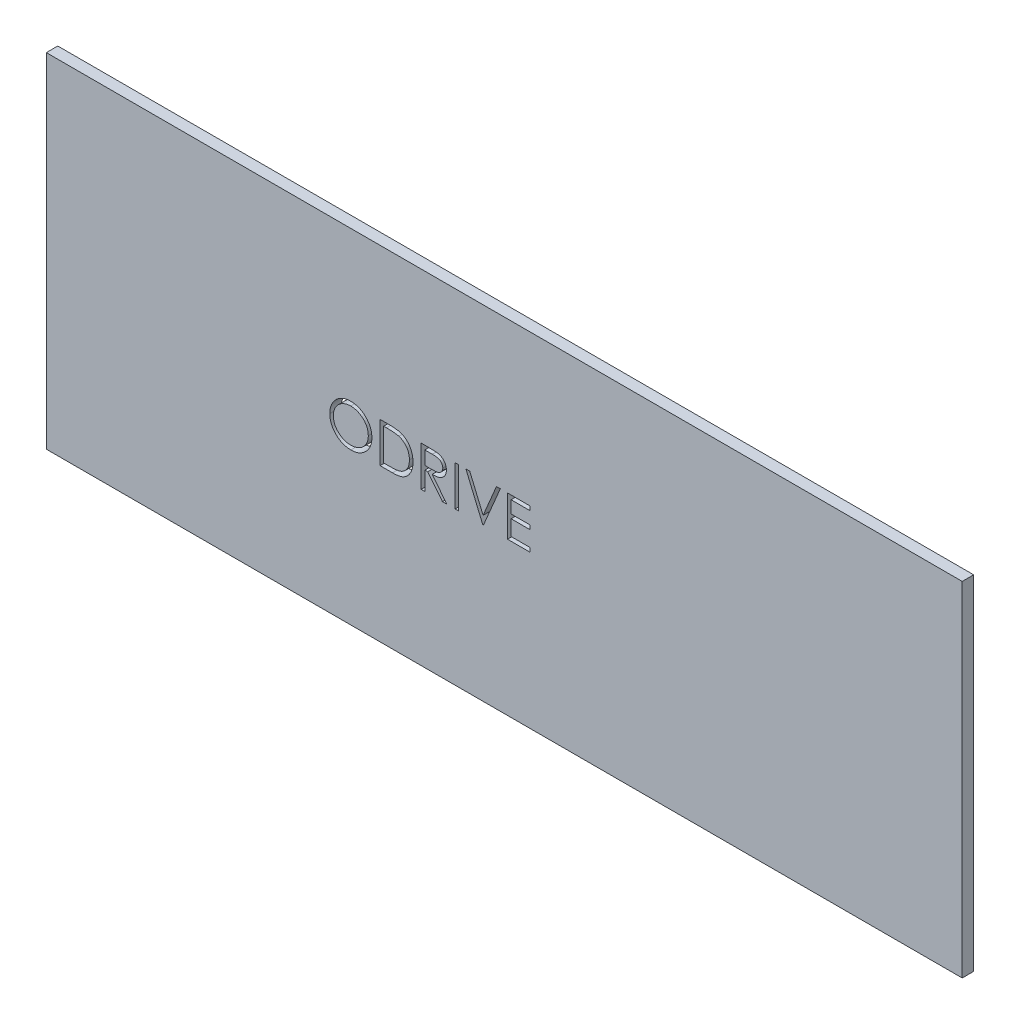
from build123d import *

# Parameters (mm, degrees)
SKETCH1_W           = 80
SKETCH1_H           = 30
BOSS_EXTRUDE1_DEPTH = 1
SKETCH2_W           = 0.314102564
SKETCH2_H           = 3.5
CUT_EXTRUDE2_DEPTH  = 68.789385784


with BuildPart() as part:
    # Sketch1 → Boss-Extrude1 (new body)
    with BuildSketch(Plane.XY):
        with Locations((-14.402403846, -25.432403846)):
            Rectangle(SKETCH1_W, SKETCH1_H)
    extrude(amount=BOSS_EXTRUDE1_DEPTH)

    # Sketch2 → Cut-Extrude2 (cut, through all)
    # profile 1 of 6: a face of its own
    with BuildSketch(Plane.XY.offset(1)):
        with BuildLine():
            add(Edge.make_bspline(
                [(-27.828685897, -23.509326923), (-27.763877792, -23.510968402), (-27.636589325, -23.514192403), (-27.449514427, -23.538871507), (-27.270919332, -23.581566897), (-27.099349193, -23.638429879), (-26.936856216, -23.714284265), (-26.782217324, -23.805969413), (-26.63580045, -23.914445872), (-26.499579068, -24.038875099), (-26.374922118, -24.174258553), (-26.265096232, -24.318736463), (-26.173053938, -24.471435265), (-26.097468151, -24.631896096), (-26.038169541, -24.799756064), (-25.997250498, -24.975910066), (-25.971112347, -25.159216756), (-25.96805657, -25.284243621), (-25.96650641, -25.347668269)],
                knots=[0, 0, 0, 0, 1.065120563, 2.091984664, 3.0946048, 4.079830382, 5.057816894, 6.036188127, 7.030412546, 8.04752943, 9.064399622, 10.05169764, 11.02544977, 11.989514704, 12.962713494, 13.945757189, 14.957906945, 16, 16, 16, 16], degree=3))
            add(Edge.make_bspline(
                [(-25.96650641, -25.347668269), (-25.968056343, -25.410625716), (-25.971111439, -25.534722136), (-25.997280217, -25.71686558), (-26.038321217, -25.891956277), (-26.096917483, -26.059701929), (-26.172142962, -26.220279493), (-26.264798133, -26.373266447), (-26.373939343, -26.518712945), (-26.498146194, -26.655025611), (-26.633547236, -26.780023081), (-26.778777503, -26.888941957), (-26.930570823, -26.982666082), (-27.090880531, -27.057449756), (-27.257580568, -27.117221676), (-27.432162891, -27.157974306), (-27.613809445, -27.184261349), (-27.737680449, -27.187279865), (-27.800641026, -27.188814103)],
                knots=[0, 0, 0, 0, 1.043624062, 2.057103931, 3.04512605, 4.022047818, 4.998200453, 5.980619268, 6.982898556, 8.009068085, 9.034988726, 10.034168286, 11.015286542, 11.987931943, 12.962482838, 13.94673481, 14.956375938, 16, 16, 16, 16], degree=3))
            add(Edge.make_bspline(
                [(-27.800641026, -27.188814103), (-27.864065345, -27.187264716), (-27.989091561, -27.184210462), (-28.172628596, -27.158029057), (-28.34890634, -27.117087753), (-28.517420691, -27.058578317), (-28.678265621, -26.982961086), (-28.831755703, -26.890756707), (-28.977274851, -26.781349566), (-29.113616597, -26.657182991), (-29.238365795, -26.522011439), (-29.347125171, -26.377177184), (-29.439350284, -26.225521728), (-29.514713617, -26.066624204), (-29.574378076, -25.901252761), (-29.615082894, -25.728304283), (-29.641418846, -25.548764778), (-29.644453693, -25.426521879), (-29.64599359, -25.364495192)],
                knots=[0, 0, 0, 0, 1.053102029, 2.075944431, 3.073151272, 4.055350789, 5.033113405, 6.020478099, 7.024410459, 8.052272461, 9.079885166, 10.07527673, 11.055994387, 12.023226415, 12.992069828, 13.970394897, 14.97016774, 16, 16, 16, 16], degree=3))
            add(Edge.make_bspline(
                [(-29.64599359, -25.364495192), (-29.645458954, -25.322862523), (-29.644396428, -25.2401224), (-29.631604735, -25.1172558), (-29.613043034, -24.996365142), (-29.586441122, -24.877794194), (-29.551649455, -24.761833209), (-29.510597427, -24.647682446), (-29.460457582, -24.536498722), (-29.403776934, -24.427755331), (-29.340515126, -24.323147425), (-29.270639376, -24.224267842), (-29.196604008, -24.130286845), (-29.115440614, -24.043639841), (-29.029824169, -23.961806185), (-28.938365791, -23.886043468), (-28.841623547, -23.815668517), (-28.739181167, -23.752248176), (-28.633562892, -23.694889041), (-28.524686114, -23.64566719), (-28.414029543, -23.603421129), (-28.301074895, -23.569180303), (-28.186122123, -23.542148267), (-28.068920338, -23.523740914), (-27.949562912, -23.510916596), (-27.869151593, -23.509859094), (-27.828685897, -23.509326923)],
                knots=[0, 0, 0, 0, 1.037015668, 2.060948919, 3.074880161, 4.083647147, 5.086022904, 6.090072063, 7.104153813, 8.122640571, 9.144368836, 10.147691507, 11.138137339, 12.123020368, 13.103399296, 14.087645067, 15.080126199, 16.082011238, 17.087798457, 18.072939717, 19.057185487, 20.037253025, 21.01195951, 21.997135196, 22.992090687, 24, 24, 24, 24], degree=3))
        make_face()
        with BuildLine():
            add(Edge.make_bspline(
                [(-27.813261218, -23.868301282), (-27.846475851, -23.868706172), (-27.912587584, -23.869512082), (-28.010872121, -23.880127798), (-28.107864055, -23.895257687), (-28.203583417, -23.916839207), (-28.297629706, -23.94624326), (-28.390879547, -23.980084168), (-28.482482601, -24.021305259), (-28.572136459, -24.067877963), (-28.659051534, -24.119426884), (-28.741064236, -24.176398651), (-28.81838688, -24.237457205), (-28.890830146, -24.302745043), (-28.958181318, -24.372594645), (-29.02176602, -24.445947081), (-29.079035601, -24.524898972), (-29.131521178, -24.607309379), (-29.178489019, -24.69307096), (-29.220254373, -24.781280822), (-29.254418382, -24.872658509), (-29.282280758, -24.966212666), (-29.305380569, -25.061795126), (-29.320014493, -25.160130975), (-29.330746853, -25.260726087), (-29.331506698, -25.328707941), (-29.331891026, -25.363092949)],
                knots=[0, 0, 0, 0, 1.008559885, 2.007477868, 2.99961109, 3.989939068, 4.984837346, 5.991145699, 7.001802488, 8.033829008, 9.059044045, 10.069351652, 11.065060232, 12.050310815, 13.029377138, 14.011219647, 14.996725999, 15.989392538, 16.977580475, 17.965360261, 18.951710183, 19.937753436, 20.929683414, 21.935841486, 22.955955122, 24, 24, 24, 24], degree=3))
            add(Edge.make_bspline(
                [(-29.331891026, -25.363092949), (-29.330616164, -25.41365517), (-29.328108116, -25.5131267), (-29.306150546, -25.658894844), (-29.272328571, -25.79898313), (-29.222471205, -25.932625039), (-29.16012059, -26.060969322), (-29.0830937, -26.182877427), (-28.991834614, -26.298382301), (-28.888171088, -26.40667757), (-28.774848381, -26.505523374), (-28.654515651, -26.592286783), (-28.528462044, -26.665697033), (-28.396358841, -26.725502105), (-28.258911302, -26.772891843), (-28.115233751, -26.805370474), (-27.966283291, -26.82674593), (-27.864752636, -26.828798685), (-27.813261218, -26.829839744)],
                knots=[0, 0, 0, 0, 1.032063989, 2.030389145, 3.003944642, 3.970395727, 4.937377036, 5.913328081, 6.909231446, 7.93887556, 8.970685674, 9.976071282, 10.964166581, 11.944589148, 12.933237628, 13.927779006, 14.949070134, 16, 16, 16, 16], degree=3))
            add(Edge.make_bspline(
                [(-27.813261218, -26.829839744), (-27.778651716, -26.829364239), (-27.71001068, -26.828421171), (-27.607915158, -26.818922494), (-27.507658946, -26.803690625), (-27.409382666, -26.781759969), (-27.313197855, -26.754312763), (-27.218703051, -26.721705035), (-27.126904761, -26.681023831), (-27.036644923, -26.63607588), (-26.950248682, -26.584835722), (-26.867773149, -26.529797573), (-26.79129717, -26.468828952), (-26.718908098, -26.404511139), (-26.651280409, -26.335547291), (-26.588871425, -26.26202707), (-26.531891293, -26.183486412), (-26.479425646, -26.101201007), (-26.432622383, -26.015204754), (-26.391843284, -25.926675076), (-26.357247169, -25.835829967), (-26.329318664, -25.742538395), (-26.307433202, -25.646977546), (-26.292353282, -25.549019468), (-26.281804843, -25.448860126), (-26.281009766, -25.38111627), (-26.280608974, -25.346967147)],
                knots=[0, 0, 0, 0, 1.047197238, 2.076906641, 3.100256066, 4.114471768, 5.12198147, 6.126382909, 7.136867548, 8.15857795, 9.17633901, 10.174870724, 11.156907918, 12.133735059, 13.104061851, 14.077631395, 15.04955518, 16.038496417, 17.029181396, 18.010275684, 18.986308667, 19.968651475, 20.955262928, 21.950658345, 22.966943676, 24, 24, 24, 24], degree=3))
            add(Edge.make_bspline(
                [(-26.280608974, -25.346967147), (-26.281010087, -25.313051643), (-26.281805769, -25.245773993), (-26.292348243, -25.146313175), (-26.307449134, -25.049059963), (-26.329211842, -24.95439616), (-26.357261996, -24.862297635), (-26.391849326, -24.772850887), (-26.432634625, -24.685722692), (-26.47944285, -24.601128395), (-26.532058673, -24.519953657), (-26.589552917, -24.442351245), (-26.652918265, -24.369778503), (-26.72034429, -24.300443809), (-26.793515175, -24.23582592), (-26.872099469, -24.175903399), (-26.955143147, -24.119230125), (-27.043070382, -24.068104563), (-27.133814336, -24.02089033), (-27.226928294, -23.980439327), (-27.321357394, -23.946067208), (-27.416861506, -23.916750243), (-27.514244484, -23.895342213), (-27.612848313, -23.880114163), (-27.712536572, -23.869515777), (-27.779579791, -23.868707398), (-27.813261218, -23.868301282)],
                knots=[0, 0, 0, 0, 1.02996197, 2.043119294, 3.035359645, 4.018872909, 4.991431989, 5.957985074, 6.929999688, 7.912076566, 8.892894881, 9.867085534, 10.843653904, 11.817741046, 12.803660682, 13.806313499, 14.818574707, 15.856120519, 16.894564902, 17.924820532, 18.937903209, 19.946497019, 20.957711757, 21.963978472, 22.977135795, 24, 24, 24, 24], degree=3))
        make_face(mode=Mode.SUBTRACT)
    # profile 2 of 6: a face of its own
    with BuildSketch(Plane.XY.offset(1)):
        with BuildLine():
            Line((-25.248557692, -27.099070513), (-25.248557692, -23.599070513))
            Line((-25.248557692, -23.599070513), (-24.541826923, -23.599070513))
            add(Edge.make_bspline(
                [(-24.541826923, -23.599070513), (-24.480357935, -23.599513083), (-24.36160017, -23.600368126), (-24.189987722, -23.605789517), (-24.03120396, -23.615379983), (-23.885771101, -23.629349509), (-23.753289889, -23.646502542), (-23.63413128, -23.668002947), (-23.527679138, -23.693391117), (-23.462209697, -23.715036567), (-23.43125, -23.725272436)],
                knots=[0, 0, 0, 0, 1.314313732, 2.53924729, 3.670748893, 4.714932338, 5.66265055, 6.526160246, 7.303039223, 8, 8, 8, 8], degree=3))
            add(Edge.make_bspline(
                [(-23.43125, -23.725272436), (-23.390755261, -23.740703142), (-23.310684068, -23.771214636), (-23.196676946, -23.828770937), (-23.089351583, -23.893984039), (-22.988132438, -23.966939901), (-22.895331612, -24.04970425), (-22.807323715, -24.138761336), (-22.727708991, -24.237349676), (-22.654800695, -24.343424664), (-22.589065036, -24.455736716), (-22.531925878, -24.574071825), (-22.484471884, -24.697829033), (-22.445078658, -24.826664181), (-22.4140322, -24.960860558), (-22.392850269, -25.100574425), (-22.378879279, -25.245253614), (-22.377475227, -25.343428078), (-22.376762821, -25.393241186)],
                knots=[0, 0, 0, 0, 0.984719456, 1.947108742, 2.898477687, 3.838006223, 4.779231079, 5.722358779, 6.681677486, 7.655904652, 8.64651281, 9.637519902, 10.640069247, 11.656948941, 12.698408672, 13.768548281, 14.867775369, 16, 16, 16, 16], degree=3))
            add(Edge.make_bspline(
                [(-22.376762821, -25.393241186), (-22.377391788, -25.436502424), (-22.378631234, -25.521753213), (-22.38976055, -25.647394109), (-22.40593687, -25.76930768), (-22.430981068, -25.88691338), (-22.461383581, -26.001241598), (-22.500347733, -26.111073843), (-22.544983229, -26.217417652), (-22.597033107, -26.318835128), (-22.654174492, -26.4149185), (-22.715496236, -26.505494028), (-22.780932931, -26.58926925), (-22.851108564, -26.666497862), (-22.92511628, -26.73706344), (-23.003440611, -26.801555456), (-23.086283662, -26.858712011), (-23.173274384, -26.910779119), (-23.266950514, -26.956199474), (-23.36908638, -26.994629484), (-23.480117558, -27.0264761), (-23.599771515, -27.053046995), (-23.728254992, -27.074124298), (-23.865693958, -27.08825069), (-24.011877248, -27.097803623), (-24.112256513, -27.098640017), (-24.163922276, -27.099070513)],
                knots=[0, 0, 0, 0, 1.105936401, 2.179363191, 3.223086493, 4.248585256, 5.251745608, 6.245858792, 7.225916811, 8.198733463, 9.158002045, 10.082870192, 10.993790845, 11.873723703, 12.748670949, 13.606408763, 14.465103618, 15.319838547, 16.196477973, 17.123216899, 18.106603292, 19.147568657, 20.255746949, 21.433717677, 22.679120308, 24, 24, 24, 24], degree=3))
            Line((-24.163922276, -27.099070513), (-25.248557692, -27.099070513))
        make_face()
        with BuildLine():
            Line((-24.934455128, -26.740096154), (-24.53271234, -26.740096154))
            add(Edge.make_bspline(
                [(-24.53271234, -26.740096154), (-24.474983969, -26.739848057), (-24.363951171, -26.739370877), (-24.204293173, -26.735183674), (-24.058413777, -26.728341737), (-23.926292267, -26.718766659), (-23.808003243, -26.706098044), (-23.703299493, -26.691973141), (-23.612524235, -26.67437569), (-23.557594798, -26.658424731), (-23.532211538, -26.651053686)],
                knots=[0, 0, 0, 0, 1.375205317, 2.645023457, 3.804390687, 4.853969522, 5.800190428, 6.637939096, 7.370582563, 8, 8, 8, 8], degree=3))
            add(Edge.make_bspline(
                [(-23.532211538, -26.651053686), (-23.500263176, -26.639802128), (-23.437129538, -26.617567754), (-23.346248453, -26.577010093), (-23.261491448, -26.528968023), (-23.181381423, -26.475565749), (-23.107054768, -26.414919747), (-23.037630651, -26.348348759), (-22.97324885, -26.275513984), (-22.914574542, -26.196505822), (-22.862066238, -26.111816026), (-22.816595009, -26.022277193), (-22.776743477, -25.928870382), (-22.745464884, -25.830161224), (-22.7209493, -25.727032165), (-22.703584612, -25.619475952), (-22.692769888, -25.50751267), (-22.69150844, -25.431360546), (-22.690865385, -25.392540064)],
                knots=[0, 0, 0, 0, 0.998632004, 1.973411704, 2.929992603, 3.868527914, 4.809262121, 5.754881198, 6.702106254, 7.672490631, 8.653608572, 9.636854334, 10.631411391, 11.644891563, 12.686317036, 13.754757253, 14.855430412, 16, 16, 16, 16], degree=3))
            add(Edge.make_bspline(
                [(-22.690865385, -25.392540064), (-22.691378672, -25.351606584), (-22.69238703, -25.271192399), (-22.70506134, -25.153201704), (-22.723582895, -25.039721054), (-22.750366582, -24.930742858), (-22.78449746, -24.826054506), (-22.827092102, -24.726234996), (-22.875758721, -24.630230127), (-22.933662058, -24.540255761), (-22.997077652, -24.455162652), (-23.067455531, -24.377207737), (-23.143677569, -24.306213436), (-23.224912419, -24.241074124), (-23.313449518, -24.184410448), (-23.407203209, -24.133723767), (-23.50754888, -24.090707875), (-23.577361576, -24.067829013), (-23.612840545, -24.056201923)],
                knots=[0, 0, 0, 0, 1.122418816, 2.205001699, 3.251619955, 4.274784885, 5.280384055, 6.268708349, 7.249350384, 8.229342522, 9.199999885, 10.157847722, 11.105861043, 12.055065948, 13.010012805, 13.98527497, 14.976112212, 16, 16, 16, 16], degree=3))
            add(Edge.make_bspline(
                [(-23.612840545, -24.056201923), (-23.642191691, -24.048085495), (-23.704600282, -24.030827743), (-23.806439746, -24.01200237), (-23.921054895, -23.995397871), (-24.048954596, -23.981339832), (-24.189993055, -23.97125251), (-24.344278743, -23.963681196), (-24.511878348, -23.958574563), (-24.628060882, -23.958225856), (-24.688361378, -23.958044872)],
                knots=[0, 0, 0, 0, 0.674548936, 1.434276114, 2.292660221, 3.240891867, 4.284742987, 5.42552168, 6.663806718, 8, 8, 8, 8], degree=3))
            Line((-24.688361378, -23.958044872), (-24.934455128, -23.958044872))
            Line((-24.934455128, -23.958044872), (-24.934455128, -26.740096154))
        make_face(mode=Mode.SUBTRACT)
    # profile 3 of 6: a face of its own
    with BuildSketch(Plane.XY.offset(1)):
        with BuildLine():
            Line((-21.658814103, -23.599070513), (-20.958393429, -23.599070513))
            add(Edge.make_bspline(
                [(-20.958393429, -23.599070513), (-20.911652301, -23.599226099), (-20.821904157, -23.599524841), (-20.693330886, -23.601190604), (-20.576503789, -23.60596496), (-20.47148395, -23.610073543), (-20.378273295, -23.617565485), (-20.296586004, -23.624726132), (-20.226798307, -23.634099792), (-20.184552455, -23.642805215), (-20.165424679, -23.646746795)],
                knots=[0, 0, 0, 0, 1.410062039, 2.707475311, 3.878576406, 4.937260626, 5.877586885, 6.699081471, 7.410979367, 8, 8, 8, 8], degree=3))
            add(Edge.make_bspline(
                [(-20.165424679, -23.646746795), (-20.139818055, -23.65307356), (-20.089151066, -23.665592124), (-20.016201, -23.692051725), (-19.946686676, -23.722671349), (-19.880896852, -23.75863507), (-19.81916106, -23.800209849), (-19.76084275, -23.846677972), (-19.705677286, -23.897785178), (-19.655895656, -23.954820019), (-19.608956604, -24.014656529), (-19.569367978, -24.079360286), (-19.535241498, -24.147021813), (-19.508070981, -24.218329231), (-19.486193008, -24.292591003), (-19.470766768, -24.370479799), (-19.461515581, -24.451640775), (-19.460573725, -24.506998683), (-19.460096154, -24.535068109)],
                knots=[0, 0, 0, 0, 1.027469482, 2.033020251, 3.019912614, 3.986113645, 4.951240523, 5.91722682, 6.890402269, 7.87763091, 8.8651537, 9.85103654, 10.82876324, 11.815024772, 12.821070561, 13.842952187, 14.906261191, 16, 16, 16, 16], degree=3))
            add(Edge.make_bspline(
                [(-19.460096154, -24.535068109), (-19.461565152, -24.581703214), (-19.464431548, -24.672700381), (-19.491156651, -24.804761263), (-19.534933171, -24.927950578), (-19.59525646, -25.042113215), (-19.672075936, -25.145023861), (-19.764400727, -25.235414316), (-19.872282338, -25.311054229), (-19.972711654, -25.363507033), (-20.061425854, -25.397099942), (-20.134459167, -25.420736301), (-20.214126144, -25.438998266), (-20.299663479, -25.455358398), (-20.391427134, -25.467710092), (-20.489197174, -25.476756687), (-20.593043326, -25.482410736), (-20.664382395, -25.48325274), (-20.701081731, -25.483685897)],
                knots=[0, 0, 0, 0, 1.260483769, 2.459530307, 3.627416485, 4.787058657, 5.939039949, 7.08810263, 8.267026773, 9.491475466, 10.141966685, 10.831826277, 11.566392101, 12.351337768, 13.187381173, 14.07005841, 15.007169909, 16, 16, 16, 16], degree=3))
            Line((-20.701081731, -25.483685897), (-19.415224359, -27.099070513))
            Line((-19.415224359, -27.099070513), (-19.803645833, -27.099070513))
            Line((-19.803645833, -27.099070513), (-21.089503205, -25.483685897))
            Line((-21.089503205, -25.483685897), (-21.344711538, -25.483685897))
            Line((-21.344711538, -25.483685897), (-21.344711538, -27.099070513))
            Line((-21.344711538, -27.099070513), (-21.658814103, -27.099070513))
            Line((-21.658814103, -27.099070513), (-21.658814103, -23.599070513))
        make_face()
        with BuildLine():
            Line((-21.344711538, -23.958044872), (-21.344711538, -25.124711538))
            Line((-21.344711538, -25.124711538), (-20.703886218, -25.129619391))
            add(Edge.make_bspline(
                [(-20.703886218, -25.129619391), (-20.673966179, -25.129632628), (-20.615972622, -25.129658284), (-20.532071957, -25.125664508), (-20.453951845, -25.12112119), (-20.381911093, -25.114171844), (-20.315917518, -25.105215772), (-20.256004105, -25.094012788), (-20.202073053, -25.080960725), (-20.139174514, -25.0607591), (-20.068937983, -25.028753081), (-19.992606523, -24.982187583), (-19.927604185, -24.923618464), (-19.872686323, -24.856645007), (-19.828556892, -24.783008759), (-19.797444837, -24.703592389), (-19.777702395, -24.620400791), (-19.77537385, -24.563222684), (-19.774198718, -24.534366987)],
                knots=[0, 0, 0, 0, 1.146690395, 2.22261258, 3.21895312, 4.145990853, 4.996080663, 5.770904154, 6.481378293, 7.121626537, 8.300444488, 9.431385265, 10.535395872, 11.636531494, 12.74115979, 13.810798291, 14.895190096, 16, 16, 16, 16], degree=3))
            add(Edge.make_bspline(
                [(-19.774198718, -24.534366987), (-19.775400839, -24.506220413), (-19.777783004, -24.450444175), (-19.797231773, -24.368788264), (-19.830121154, -24.291721314), (-19.874443392, -24.219556829), (-19.928442547, -24.154051094), (-19.99176036, -24.09800394), (-20.062665555, -24.051754476), (-20.128936753, -24.022200095), (-20.188170966, -24.004080242), (-20.239600626, -23.991329078), (-20.297712104, -23.981084609), (-20.362787562, -23.972876548), (-20.434549193, -23.965821604), (-20.513359844, -23.961069825), (-20.598696624, -23.958255961), (-20.657843556, -23.958116873), (-20.688461538, -23.958044872)],
                knots=[0, 0, 0, 0, 1.101028733, 2.181837193, 3.264309656, 4.369019818, 5.486613113, 6.575447106, 7.666700264, 8.788928104, 9.402425223, 10.0903467, 10.862060571, 11.710948788, 12.657782767, 13.684531032, 14.801375019, 16, 16, 16, 16], degree=3))
            Line((-20.688461538, -23.958044872), (-21.344711538, -23.958044872))
        make_face(mode=Mode.SUBTRACT)
    # profile 4 of 6: a face of its own
    with BuildSketch(Plane.XY.offset(1)):
        with Locations((-18.540224359, -25.349070513)):
            Rectangle(SKETCH2_W, SKETCH2_H)
    # profile 5 of 6: a face of its own
    with BuildSketch(Plane.XY.offset(1)):
        Polygon((-17.754967949, -23.599070513), (-17.418429487, -23.599070513), (-16.251762821, -26.357283654), (-15.085096154, -23.599070513), (-14.748557692, -23.599070513), (-16.229326923, -27.099070513), (-16.274198718, -27.099070513), align=None)
    # profile 6 of 6: a face of its own
    with BuildSketch(Plane.XY.offset(1)):
        Polygon((-14.120352564, -23.599070513), (-12.14599359, -23.599070513), (-12.14599359, -23.958044872), (-13.80625, -23.958044872), (-13.80625, -25.034967949), (-12.14599359, -25.034967949), (-12.14599359, -25.393942308), (-13.80625, -25.393942308), (-13.80625, -26.740096154), (-12.14599359, -26.740096154), (-12.14599359, -27.099070513), (-14.120352564, -27.099070513), align=None)
    extrude(amount=-CUT_EXTRUDE2_DEPTH, mode=Mode.SUBTRACT)


with BuildPart() as cut_extrude2_piece_1:
    # of the separate pieces the step leaves, piece 1, a body of its own (cut_extrude2_pieces)
    add(part.part.solids().sort_by_distance((-54.402403846, -10.432403846, 0))[0])


with BuildPart() as cut_extrude2_piece_2:
    # of the separate pieces the step leaves, piece 2, a body of its own (cut_extrude2_pieces)
    add(part.part.solids().sort_by_distance((-27.813261218, -26.829839744, 0))[0])


with BuildPart() as cut_extrude2_piece_3:
    # of the separate pieces the step leaves, piece 3, a body of its own (cut_extrude2_pieces)
    add(part.part.solids().sort_by_distance((-23.532211538, -26.651053686, 0))[0])


with BuildPart() as cut_extrude2_piece_4:
    # of the separate pieces the step leaves, piece 4, a body of its own (cut_extrude2_pieces)
    add(part.part.solids().sort_by_distance((-20.703886218, -25.129619391, 0))[0])


solid = Compound([cut_extrude2_piece_1.part, cut_extrude2_piece_2.part, cut_extrude2_piece_3.part, cut_extrude2_piece_4.part])
